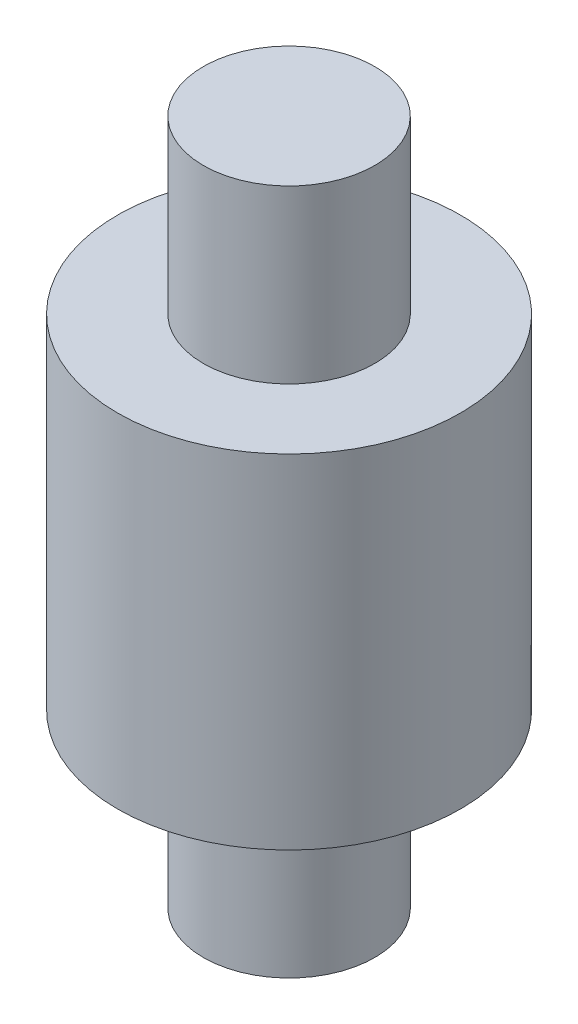
from build123d import *

# Parameters (mm, degrees)
SKETCH_1_R      = 1
EXTRUDE_1_DEPTH = 2
SKETCH_2_R      = 2
EXTRUDE_2_DEPTH = 4
SKETCH_3_R      = 1
EXTRUDE_3_DEPTH = 2


with BuildPart() as part:
    # 草图1 → 凸台-拉伸1 (new body)
    with BuildSketch(Plane(origin=(0, 0, 0), x_dir=(1, 0, 0), z_dir=(0, 1, 0))):
        with Locations(Location((0, 0, 0), (0, 0, 270))):
            Circle(SKETCH_1_R)
    extrude(amount=EXTRUDE_1_DEPTH)

    # 草图2 → 凸台-拉伸2 (add)
    with BuildSketch(Plane(origin=(0, 2, 0), x_dir=(1, 0, 0), z_dir=(0, 1, 0))):
        with Locations(Location((0, 0, 0), (0, 0, 270))):
            Circle(SKETCH_2_R)
    extrude(amount=EXTRUDE_2_DEPTH)

    # 草图3 → 凸台-拉伸3 (add)
    with BuildSketch(Plane(origin=(0, 6, 0), x_dir=(1, 0, 0), z_dir=(0, 1, 0))):
        with Locations(Location((0, 0, 0), (0, 0, 270))):
            Circle(SKETCH_3_R)
    extrude(amount=EXTRUDE_3_DEPTH)


solid = part.part
